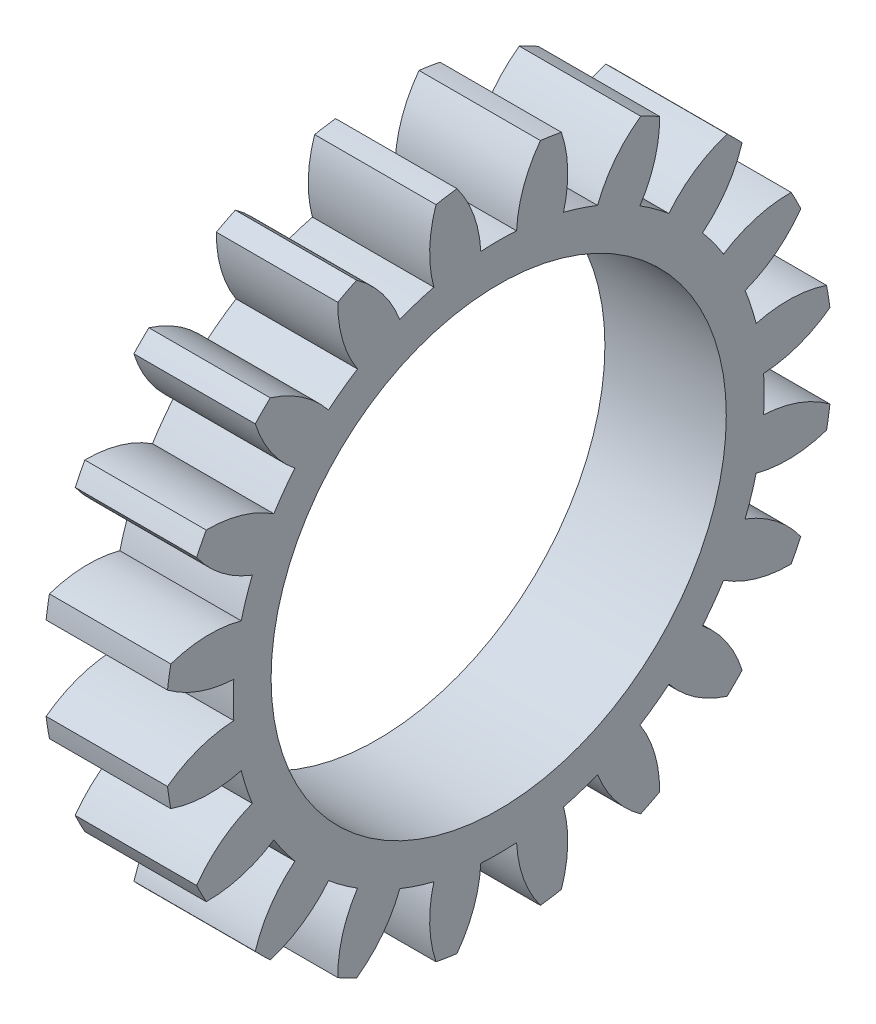
from build123d import *

# Parameters (mm, degrees)
BASPROSKE_W     = 4
BASPROSKE_H     = 11
TOOTHCUT_DEPTH  = 17.062378404
TEETHCUTS_COUNT = 20
TEETHCUTS_ANGLE = 342
BORSKE_R        = 7.5
BORE_DEPTH      = 50.0000508


with BuildPart() as part:
    # BasProSke → Base-Revolve (revolve)
    with BuildSketch(Plane(origin=(0, 0, 0), x_dir=(1, 0, 0), z_dir=(0, 1, 0)), mode=Mode.PRIVATE) as base_revolve_sk:
        with Locations((2, 5.5)):
            Rectangle(BASPROSKE_W, BASPROSKE_H)
    revolve(base_revolve_sk.sketch.rotate(Axis((-10, 0, 0), (1, 0, 0)), 180), axis=Axis((-10, 0, 0), (1, 0, 0)))

    # TooCutSke → ToothCut (cut, through all)
    with BuildSketch(Plane(origin=(0, 0, 0), x_dir=(0, 0, -1), z_dir=(1, 0, 0))):
        with BuildLine():
            ThreePointArc((0.589353609, 8.729127295), (0, 8.749), (-0.589353609, 8.729127295))
            ThreePointArc((-0.589353609, 8.729127295), (-0.82475631, 9.893403384), (-1.391689312, 10.937213814))
            ThreePointArc((-1.391689312, 10.937213814), (0, 11.0254), (1.391689312, 10.937213814))
            ThreePointArc((1.391689312, 10.937213814), (0.82475631, 9.893403384), (0.589353609, 8.729127295))
        make_face()
    toothcut = extrude(amount=TOOTHCUT_DEPTH, mode=Mode.SUBTRACT)

    # TeethCuts: ToothCut ×20 about axis
    teethcuts_axis = Axis((-10, 0, 0), (1, 0, 0))
    for i in range(1, TEETHCUTS_COUNT):
        add(toothcut.rotate(teethcuts_axis, i * TEETHCUTS_ANGLE / (TEETHCUTS_COUNT - 1)), mode=Mode.SUBTRACT)

    # BorSke → Bore (cut, symmetric)
    with BuildSketch(Plane(origin=(0, 0, 0), x_dir=(0, 0, -1), z_dir=(1, 0, 0))):
        with Locations(Location((0, 0, 0), (0, 0, 180))):
            Circle(BORSKE_R)
    extrude(amount=BORE_DEPTH, both=True, mode=Mode.SUBTRACT)


solid = part.part
